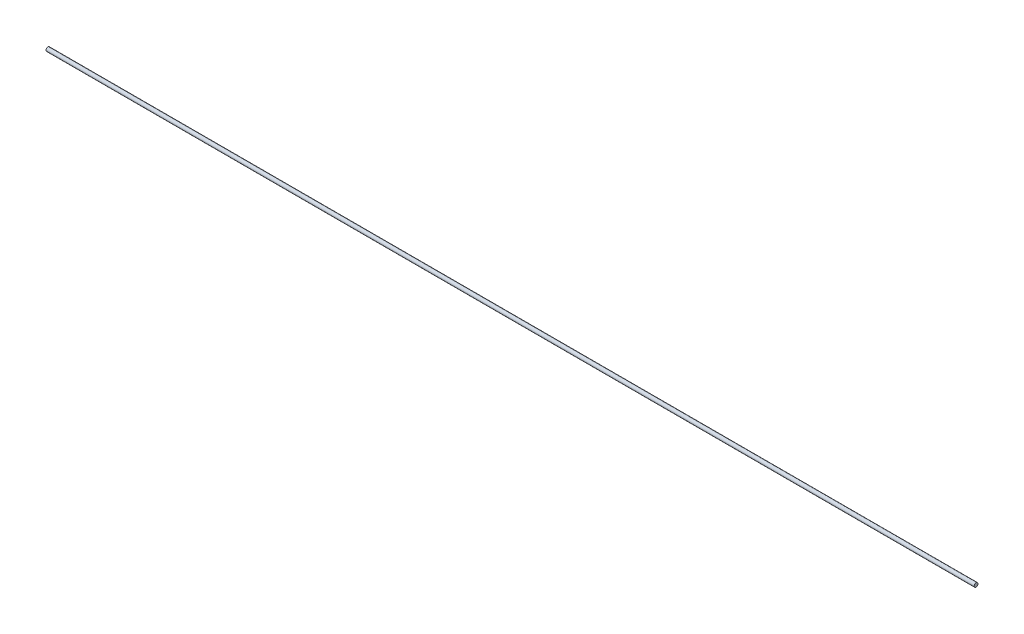
from build123d import *

# Parameters (mm, degrees)
SKETCH_1_R      = 0.415
EXTRUDE_1_DEPTH = 200


with BuildPart() as part:
    # Эскиз1 → Вытянуть1 (new body)
    with BuildSketch(Plane(origin=(0, 0, 0), x_dir=(0, 0, -1), z_dir=(1, 0, 0))):
        Circle(SKETCH_1_R)
    extrude(amount=EXTRUDE_1_DEPTH)


solid = part.part
